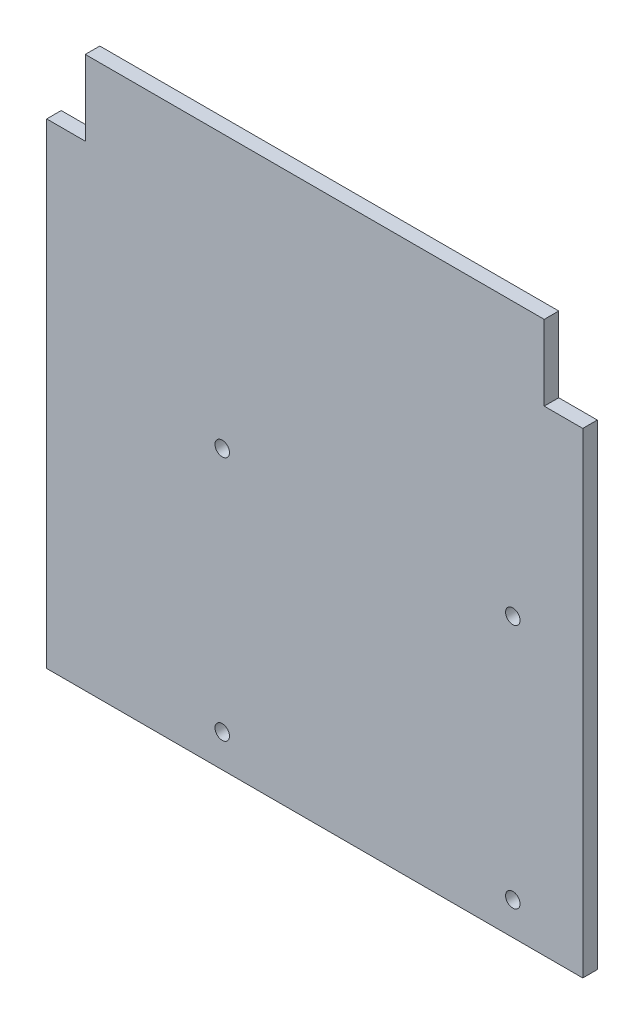
from build123d import *

# Parameters (mm, degrees)
SKETCH1_R           = 1.45
BOSS_EXTRUDE2_DEPTH = 2.9


with BuildPart() as part:
    # Sketch1 → Boss-Extrude2 (new body)
    with BuildSketch(Plane.XY):
        Polygon((-53.5, -47.5), (53.5, -47.5), (53.5, 47.5), (45.801952589, 47.5), (45.801952589, 62.5), (-45.801952589, 62.5), (-45.801952589, 47.5), (-53.5, 47.5), align=None)
        with Locations((39.536746358, -40.952272815)):
            Circle(SKETCH1_R, mode=Mode.SUBTRACT)
        with Locations((39.536746358, 8.047727185)):
            Circle(SKETCH1_R, mode=Mode.SUBTRACT)
        with Locations((-18.463253642, -40.952272815)):
            Circle(SKETCH1_R, mode=Mode.SUBTRACT)
        with Locations((-18.463253642, 8.047727185)):
            Circle(SKETCH1_R, mode=Mode.SUBTRACT)
    extrude(amount=BOSS_EXTRUDE2_DEPTH)


solid = part.part
